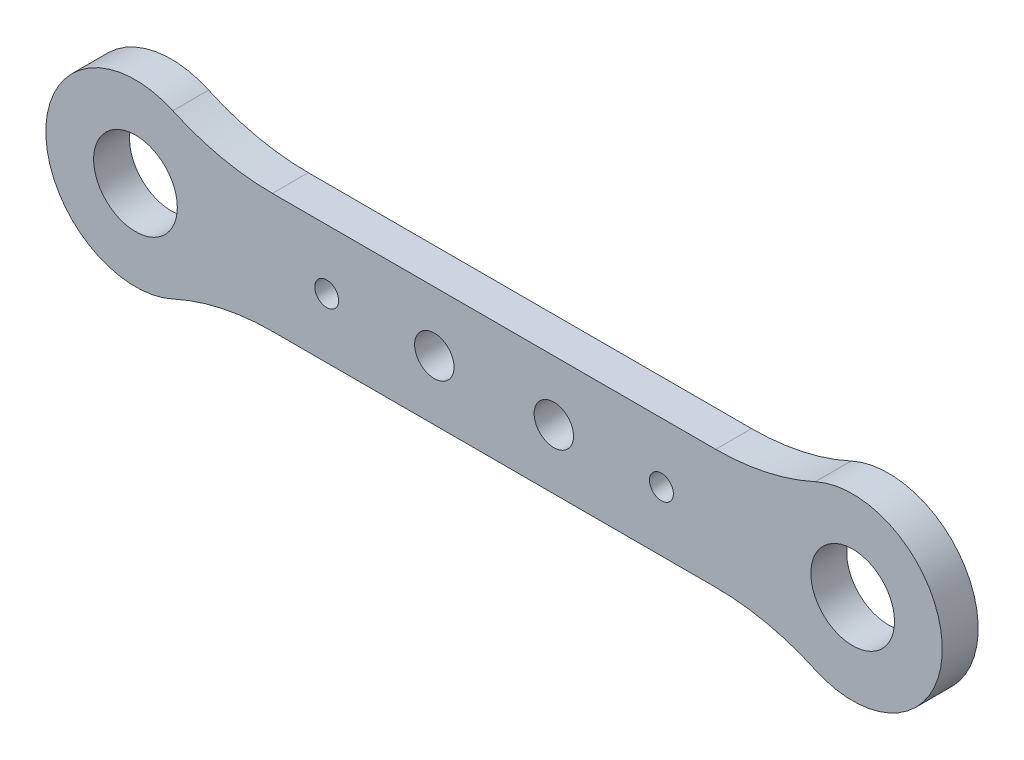
from build123d import *

# Parameters (mm, degrees)
ESBO_O1_R                = 1
ESBO_O1_R_2              = 3.5
ESBO_O1_R_3              = 1.65
RESSALTO_EXTRUS_O1_DEPTH = 3
FILETE1_R                = 20


with BuildPart() as part:
    # Esboço1 → Ressalto-extrusão1 (new body)
    with BuildSketch(Plane.XY):
        with BuildLine():
            Line((5.590169944, -5), (54.409830056, -5))
            ThreePointArc((54.409830056, -5), (67.5, 0), (54.409830056, 5))
            Line((54.409830056, 5), (5.590169944, 5))
            ThreePointArc((5.590169944, 5), (-7.5, 0), (5.590169944, -5))
        make_face()
        with Locations((44, 0)):
            Circle(ESBO_O1_R, mode=Mode.SUBTRACT)
        with Locations((16, 0)):
            Circle(ESBO_O1_R, mode=Mode.SUBTRACT)
        Circle(ESBO_O1_R_2, mode=Mode.SUBTRACT)
        with Locations((60, 0)):
            Circle(ESBO_O1_R_2, mode=Mode.SUBTRACT)
        with Locations((25, 0)):
            Circle(ESBO_O1_R_3, mode=Mode.SUBTRACT)
        with Locations((35, 0)):
            Circle(ESBO_O1_R_3, mode=Mode.SUBTRACT)
    extrude(amount=RESSALTO_EXTRUS_O1_DEPTH)

    # Filete1
    filete1_edges = [part.edges().sort_by_distance(p)[0] for p in [
        (54.409830056, -5, 1.5),
        (5.590169944, -5, 1.5),
        (5.590169944, 5, 1.5),
        (54.409830056, 5, 1.5),
    ]]
    fillet(filete1_edges, radius=FILETE1_R)


solid = part.part
